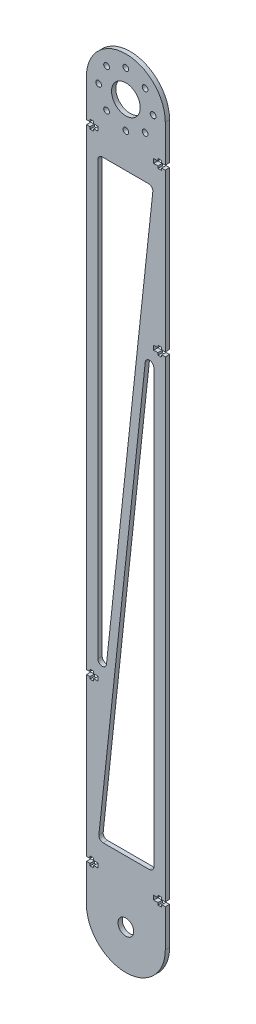
from build123d import *

# Parameters (mm, degrees)
SKETCH_1_R      = 10
SKETCH_1_R_2    = 2
SKETCH_1_R_3    = 5.5
EXTRUDE_1_DEPTH = 3


with BuildPart() as part:
    # 草图1 → 凸台-拉伸1 (new body)
    with BuildSketch(Plane.XY):
        with BuildLine():
            Line((224.953360513, -85.216557036), (224.953360513, -86.716557036))
            Line((224.953360513, -86.716557036), (227.553360513, -86.716557036))
            Line((227.553360513, -86.716557036), (227.553360513, -85.216557036))
            Line((227.553360513, -85.216557036), (230.553360513, -85.216557036))
            Line((230.553360513, -85.216557036), (230.553360513, -82.216557036))
            Line((230.553360513, -82.216557036), (227.553360513, -82.216557036))
            Line((227.553360513, -82.216557036), (227.553360513, -80.716557036))
            Line((227.553360513, -80.716557036), (224.953360513, -80.716557036))
            Line((224.953360513, -80.716557036), (224.953360513, -82.216557036))
            Line((224.953360513, -82.216557036), (222.453360513, -82.216557036))
            Line((222.453360513, -82.216557036), (222.453360513, 246.962931603))
            Line((222.453360513, 246.962931603), (224.953360513, 246.962931603))
            Line((224.953360513, 246.962931603), (224.953360513, 245.462931603))
            Line((224.953360513, 245.462931603), (227.553360513, 245.462931603))
            Line((227.553360513, 245.462931603), (227.553360513, 246.962931603))
            Line((227.553360513, 246.962931603), (230.553360513, 246.962931603))
            Line((230.553360513, 246.962931603), (230.553360513, 249.962931603))
            Line((230.553360513, 249.962931603), (227.553360513, 249.962931603))
            Line((227.553360513, 249.962931603), (227.553360513, 251.462931603))
            Line((227.553360513, 251.462931603), (224.953360513, 251.462931603))
            Line((224.953360513, 251.462931603), (224.953360513, 249.962931603))
            Line((224.953360513, 249.962931603), (222.453360513, 249.962931603))
            Line((222.453360513, 249.962931603), (222.453360513, 275.962931603))
            ThreePointArc((222.453360513, 275.962931603), (249.953360513, 303.462931603), (277.453360513, 275.962931603))
            Line((277.453360513, 275.962931603), (277.453360513, 249.962931603))
            Line((277.453360513, 249.962931603), (274.953360513, 249.962931603))
            Line((274.953360513, 249.962931603), (274.953360513, 251.462931603))
            Line((274.953360513, 251.462931603), (272.353360513, 251.462931603))
            Line((272.353360513, 251.462931603), (272.353360513, 249.962931603))
            Line((272.353360513, 249.962931603), (269.353360513, 249.962931603))
            Line((269.353360513, 249.962931603), (269.353360513, 246.962931603))
            Line((269.353360513, 246.962931603), (272.353360513, 246.962931603))
            Line((272.353360513, 246.962931603), (272.353360513, 245.462931603))
            Line((272.353360513, 245.462931603), (274.953360513, 245.462931603))
            Line((274.953360513, 245.462931603), (274.953360513, 246.962931603))
            Line((274.953360513, 246.962931603), (277.453360513, 246.962931603))
            Line((277.453360513, 246.962931603), (277.453360513, 137.142420241))
            Line((277.453360513, 137.142420241), (274.953360513, 137.142420241))
            Line((274.953360513, 137.142420241), (274.953360513, 138.642420241))
            Line((274.953360513, 138.642420241), (272.353360513, 138.642420241))
            Line((272.353360513, 138.642420241), (272.353360513, 137.142420241))
            Line((272.353360513, 137.142420241), (269.353360513, 137.142420241))
            Line((269.353360513, 137.142420241), (269.353360513, 134.142420241))
            Line((269.353360513, 134.142420241), (272.353360513, 134.142420241))
            Line((272.353360513, 134.142420241), (272.353360513, 132.642420241))
            Line((272.353360513, 132.642420241), (274.953360513, 132.642420241))
            Line((274.953360513, 132.642420241), (274.953360513, 134.142420241))
            Line((274.953360513, 134.142420241), (277.453360513, 134.142420241))
            Line((277.453360513, 134.142420241), (277.453360513, -195.037068397))
            Line((277.453360513, -195.037068397), (274.953360513, -195.037068397))
            Line((274.953360513, -195.037068397), (274.953360513, -193.537068397))
            Line((274.953360513, -193.537068397), (272.353360513, -193.537068397))
            Line((272.353360513, -193.537068397), (272.353360513, -195.037068397))
            Line((272.353360513, -195.037068397), (269.353360513, -195.037068397))
            Line((269.353360513, -195.037068397), (269.353360513, -198.037068397))
            Line((269.353360513, -198.037068397), (272.353360513, -198.037068397))
            Line((272.353360513, -198.037068397), (272.353360513, -199.537068397))
            Line((272.353360513, -199.537068397), (274.953360513, -199.537068397))
            Line((274.953360513, -199.537068397), (274.953360513, -198.037068397))
            Line((274.953360513, -198.037068397), (277.453360513, -198.037068397))
            Line((277.453360513, -198.037068397), (277.453360513, -224.037068397))
            ThreePointArc((277.453360513, -224.037068397), (249.953360513, -251.537068397), (222.453360513, -224.037068397))
            Line((222.453360513, -224.037068397), (222.453360513, -198.037068397))
            Line((222.453360513, -198.037068397), (224.953360513, -198.037068397))
            Line((224.953360513, -198.037068397), (224.953360513, -199.537068397))
            Line((224.953360513, -199.537068397), (227.553360513, -199.537068397))
            Line((227.553360513, -199.537068397), (227.553360513, -198.037068397))
            Line((227.553360513, -198.037068397), (230.553360513, -198.037068397))
            Line((230.553360513, -198.037068397), (230.553360513, -195.037068397))
            Line((230.553360513, -195.037068397), (227.553360513, -195.037068397))
            Line((227.553360513, -195.037068397), (227.553360513, -193.537068397))
            Line((227.553360513, -193.537068397), (224.953360513, -193.537068397))
            Line((224.953360513, -193.537068397), (224.953360513, -195.037068397))
            Line((224.953360513, -195.037068397), (222.453360513, -195.037068397))
            Line((222.453360513, -195.037068397), (222.453360513, -85.216557036))
            Line((222.453360513, -85.216557036), (224.953360513, -85.216557036))
        make_face()
        with Locations((249.953360513, 275.962931603)):
            Circle(SKETCH_1_R, mode=Mode.SUBTRACT)
        with Locations((230.953360513, 275.962931603)):
            Circle(SKETCH_1_R_2, mode=Mode.SUBTRACT)
        with Locations((236.518331671, 289.397960445)):
            Circle(SKETCH_1_R_2, mode=Mode.SUBTRACT)
        with Locations((249.953360513, 294.962931603)):
            Circle(SKETCH_1_R_2, mode=Mode.SUBTRACT)
        with Locations((263.388389356, 289.397960445)):
            Circle(SKETCH_1_R_2, mode=Mode.SUBTRACT)
        with Locations((268.953360513, 275.962931603)):
            Circle(SKETCH_1_R_2, mode=Mode.SUBTRACT)
        with Locations((263.388389356, 262.52790276)):
            Circle(SKETCH_1_R_2, mode=Mode.SUBTRACT)
        with Locations((249.953360513, 256.962931603)):
            Circle(SKETCH_1_R_2, mode=Mode.SUBTRACT)
        with Locations((236.518331671, 262.52790276)):
            Circle(SKETCH_1_R_2, mode=Mode.SUBTRACT)
        with Locations((249.953360513, -224.037068397)):
            Circle(SKETCH_1_R_3, mode=Mode.SUBTRACT)
        with BuildLine():
            Line((233.453360513, 232.962931603), (265.776162867, 232.962931603))
            ThreePointArc((265.776162867, 232.962931603), (268.007619579, 231.968075224), (268.759090329, 229.643332232))
            Line((268.759090329, 229.643332232), (236.436287975, -72.036156407))
            ThreePointArc((236.436287975, -72.036156407), (233.293332993, -74.712285861), (230.453360513, -71.716557036))
            Line((230.453360513, -71.716557036), (230.453360513, 229.962931603))
            ThreePointArc((230.453360513, 229.962931603), (231.33204017, 232.084251946), (233.453360513, 232.962931603))
        make_face(mode=Mode.SUBTRACT)
        with BuildLine():
            Line((269.453360513, 123.642420241), (269.453360513, -178.037068397))
            ThreePointArc((269.453360513, -178.037068397), (268.574680857, -180.158388741), (266.453360513, -181.037068397))
            Line((266.453360513, -181.037068397), (234.130558159, -181.037068397))
            ThreePointArc((234.130558159, -181.037068397), (231.899101447, -180.042212019), (231.147630697, -177.717469026))
            Line((231.147630697, -177.717469026), (263.470433052, 123.962019612))
            ThreePointArc((263.470433052, 123.962019612), (266.613388034, 126.638149066), (269.453360513, 123.642420241))
        make_face(mode=Mode.SUBTRACT)
    extrude(amount=EXTRUDE_1_DEPTH)


solid = part.part
